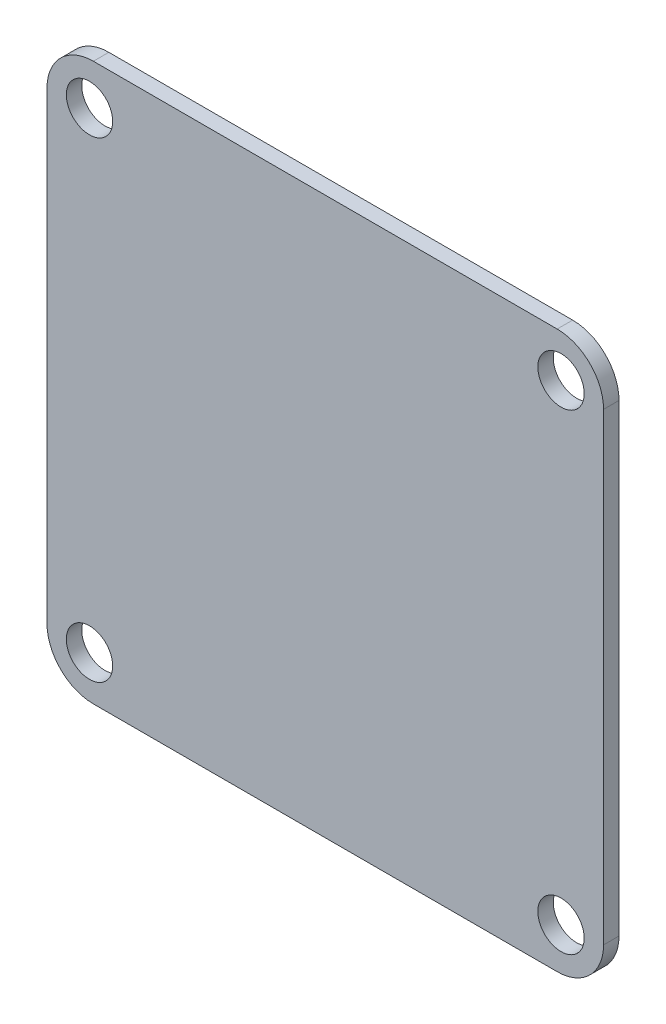
from build123d import *

# Parameters (mm, degrees)
SKETCH_1_W          = 36
SKETCH_1_H          = 36
EXTRUDE_1_DEPTH     = 1
FILLET_1_R          = 3
SKETCH_2_R          = 1.5
CUT_EXTRUDE_1_DEPTH = 1


with BuildPart() as part:
    # 草图1 → 凸台-拉伸1 (new body)
    with BuildSketch(Plane.XY):
        Rectangle(SKETCH_1_W, SKETCH_1_H)
    extrude(amount=EXTRUDE_1_DEPTH)

    # 圆角1
    fillet_1_edges = [part.edges().sort_by_distance(p)[0] for p in [
        (-18, 18, 0.5),
        (18, 18, 0.5),
        (18, -18, 0.5),
        (-18, -18, 0.5),
    ]]
    fillet(fillet_1_edges, radius=FILLET_1_R)

    # 草图2 → 切除-拉伸1 (cut)
    with BuildSketch(Plane.XY.offset(1)):
        with Locations((-15.25, 15.25)):
            Circle(SKETCH_2_R)
        with Locations((15.25, 15.25)):
            Circle(SKETCH_2_R)
        with Locations((15.25, -15.25)):
            Circle(SKETCH_2_R)
        with Locations((-15.25, -15.25)):
            Circle(SKETCH_2_R)
    extrude(amount=-CUT_EXTRUDE_1_DEPTH, mode=Mode.SUBTRACT)


solid = part.part
